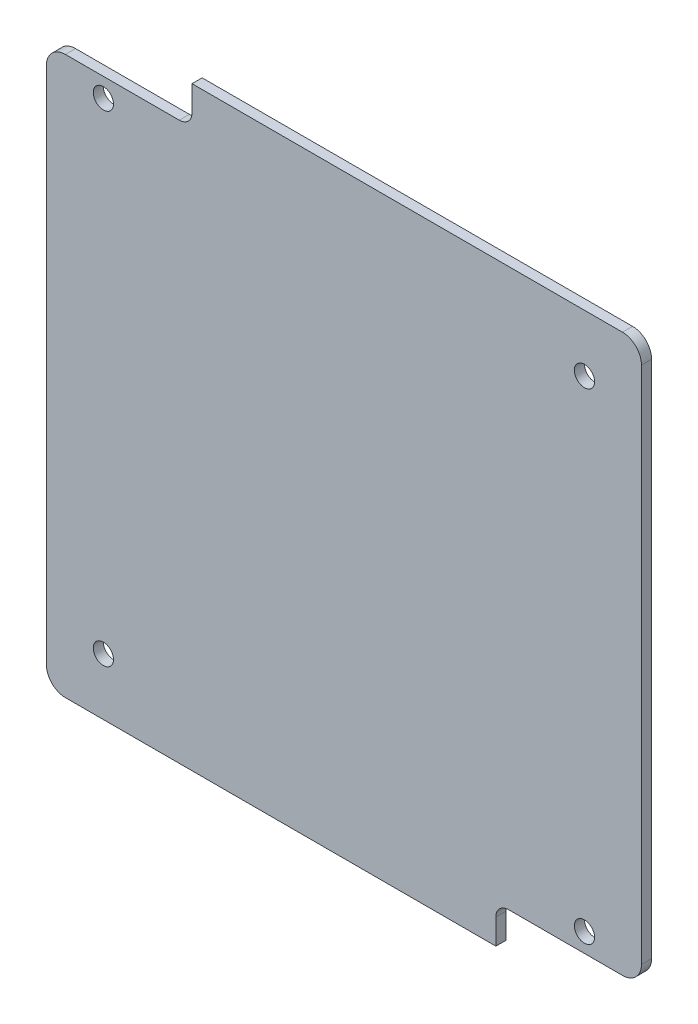
from build123d import *

# Parameters (mm, degrees)
BOSS_EXTRUDE1_DEPTH        = 1.6
F_3_2_3_2_DIAMETER_HOLE3_D = 3.2


with BuildPart() as part:
    # Sketch1 → Boss-Extrude1 (new body)
    with BuildSketch(Plane.XY):
        with BuildLine():
            Line((-16.56534388, -2.04814307), (-84.56534388, -2.04814307))
            ThreePointArc((-84.56534388, -2.04814307), (-86.686664224, -1.169463413), (-87.56534388, 0.95185693))
            Line((-87.56534388, 0.95185693), (-87.56534388, 82.95185693))
            ThreePointArc((-87.56534388, 82.95185693), (-86.686664224, 85.073177274), (-84.56534388, 85.95185693))
            Line((-84.56534388, 85.95185693), (-66.56534388, 85.95185693))
            ThreePointArc((-66.56534388, 85.95185693), (-65.151130318, 86.537643368), (-64.56534388, 87.95185693))
            Line((-64.56534388, 87.95185693), (-64.56534388, 91.95185693))
            Line((-64.56534388, 91.95185693), (3.43465612, 91.95185693))
            ThreePointArc((3.43465612, 91.95185693), (5.555976464, 91.073177274), (6.43465612, 88.95185693))
            Line((6.43465612, 88.95185693), (6.43465612, 6.95185693))
            ThreePointArc((6.43465612, 6.95185693), (5.555976464, 4.830536587), (3.43465612, 3.95185693))
            Line((3.43465612, 3.95185693), (-14.56534388, 3.95185693))
            ThreePointArc((-14.56534388, 3.95185693), (-15.979557442, 3.366070492), (-16.56534388, 1.95185693))
            Line((-16.56534388, 1.95185693), (-16.56534388, -2.04814307))
        make_face()
    extrude(amount=BOSS_EXTRUDE1_DEPTH)

    # Ø3.2 (3.2) Diameter Hole3 (through all)
    with Locations(Plane(origin=(0, 0, 0), x_dir=(-1, 0, 0), z_dir=(0, 0, -1))):
        with Locations((78.56534388, 6.95185693), (78.56534388, 82.95185693), (2.56534388, 82.95185693), (2.56534388, 6.95185693)):
            Hole(F_3_2_3_2_DIAMETER_HOLE3_D / 2)


solid = part.part
